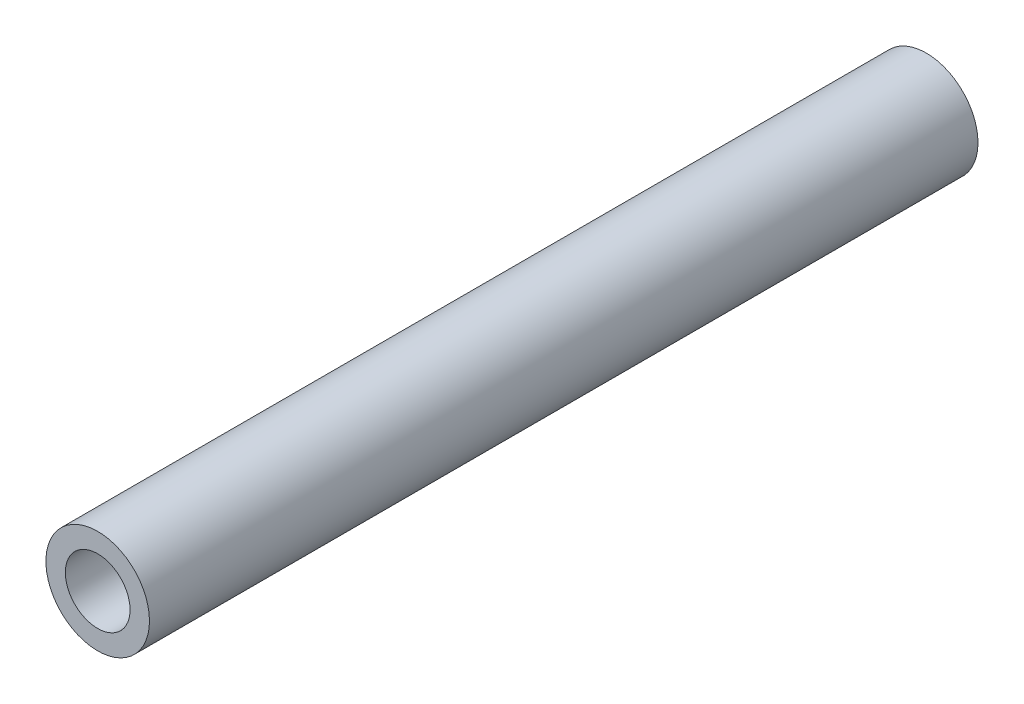
from build123d import *

# Parameters (mm, degrees)
SKETCH_1_R      = 2
SKETCH_1_R_2    = 1.25
EXTRUDE_1_DEPTH = 32


with BuildPart() as part:
    # 草图1 → 凸台-拉伸1 (new body)
    with BuildSketch(Plane.XY):
        Circle(SKETCH_1_R)
        Circle(SKETCH_1_R_2, mode=Mode.SUBTRACT)
    extrude(amount=EXTRUDE_1_DEPTH)


solid = part.part
